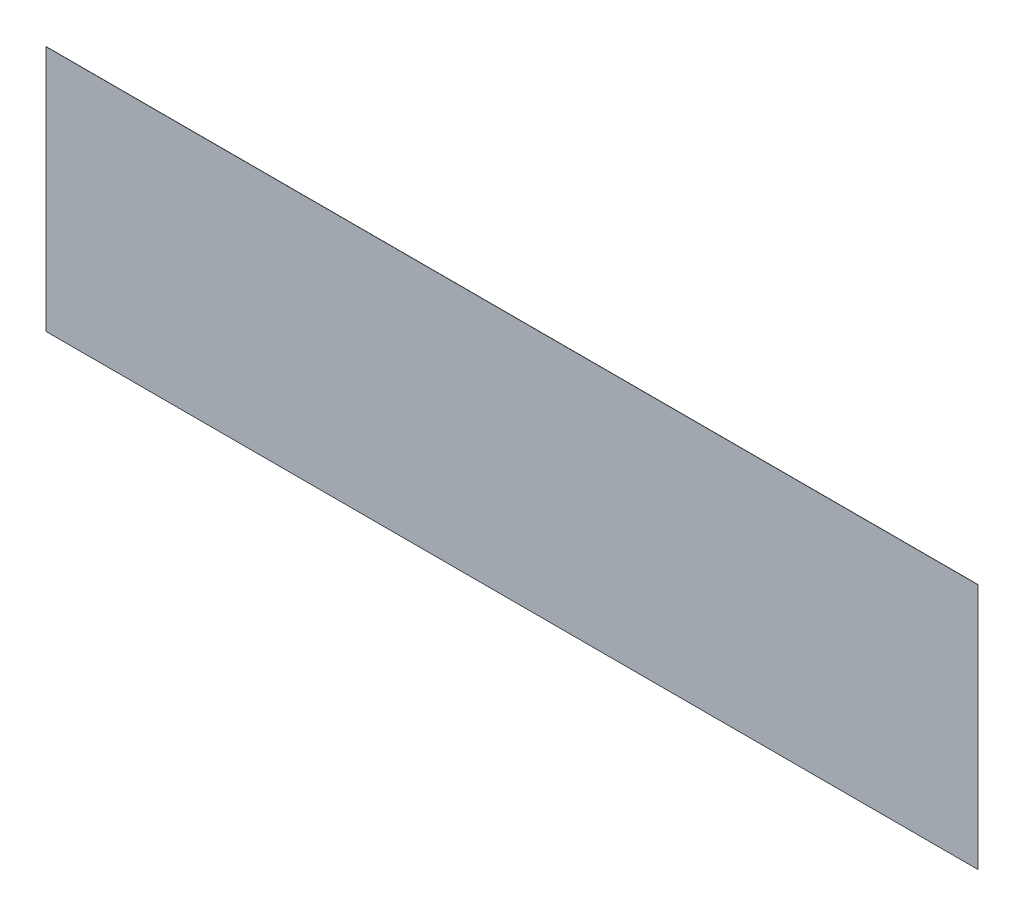
from build123d import *

# Parameters (mm, degrees)
SKETCH1_W           = 47916
SKETCH1_H           = 12681.5
BOSS_EXTRUDE1_DEPTH = 10


with BuildPart() as part:
    # Sketch1 → Boss-Extrude1 (new body)
    with BuildSketch(Plane.XY):
        with Locations((23958, 6340.75)):
            Rectangle(SKETCH1_W, SKETCH1_H)
    extrude(amount=-BOSS_EXTRUDE1_DEPTH)


solid = part.part
